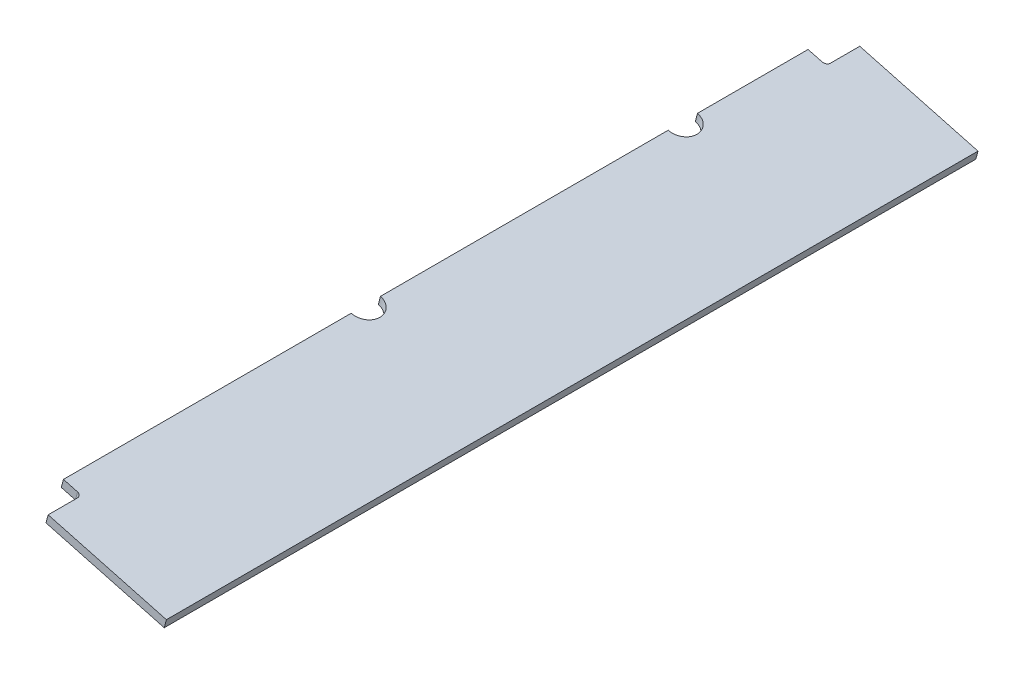
from build123d import *

# Parameters (mm, degrees)
BOSS_EXTRUDE1_DEPTH = 1231.392
SKETCH5_R           = 22.225
SKETCH5_W           = 28.575
SKETCH5_H           = 50.8
CUT_EXTRUDE2_DEPTH  = 1252.786284181
FILLET1_R           = 6.35


with BuildPart() as part:
    # Sketch1 → Boss-Extrude1 (new body)
    with BuildSketch(Plane.XY):
        Polygon((232.654542571, 12.267259413), (25.64456355, 67.73541462), (22.35756176, 55.468156604), (229.367540781, 1.397e-06), align=None)
    extrude(amount=BOSS_EXTRUDE1_DEPTH)

    # Sketch5 → Cut-Extrude2 (cut, through all)
    with BuildSketch(Plane(origin=(18.651713196, 69.609143174, 0), x_dir=(0.9659258280351158, -0.25881903858618227, 0), z_dir=(0.2588190385861823, 0.965925828035116, 0))):
        with Locations((7.239531392, -721.8045)):
            Circle(SKETCH5_R)
        with Locations((7.239531392, -240.792)):
            Circle(SKETCH5_R)
        with Locations((21.527031392, -1205.992)):
            Rectangle(SKETCH5_W, SKETCH5_H)
        with Locations((21.527031392, -25.4)):
            Rectangle(SKETCH5_W, SKETCH5_H)
    extrude(amount=-CUT_EXTRUDE2_DEPTH, mode=Mode.SUBTRACT)

    # Fillet1
    fillet1_edges = [part.edges().sort_by_distance(p)[0] for p in [
        (51.602393192, 54.206031584, 1180.592),
        (51.602393192, 54.206031584, 50.8),
    ]]
    fillet(fillet1_edges, radius=FILLET1_R)


solid = part.part
